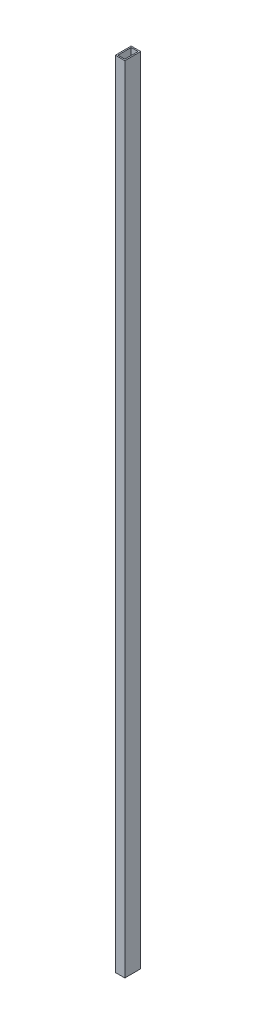
from build123d import *

# Parameters (mm, degrees)
SKETCH_1_W      = 30
SKETCH_1_H      = 50
SKETCH_1_W_2    = 22
SKETCH_1_H_2    = 42
EXTRUDE_1_DEPTH = 2500


with BuildPart() as part:
    # Эскиз1 → Бобышка-Вытянуть1 (new body)
    with BuildSketch(Plane(origin=(0, 0, 0), x_dir=(1, 0, 0), z_dir=(0, 1, 0))):
        Rectangle(SKETCH_1_W, SKETCH_1_H)
        Rectangle(SKETCH_1_W_2, SKETCH_1_H_2, mode=Mode.SUBTRACT)
    extrude(amount=EXTRUDE_1_DEPTH)


solid = part.part
